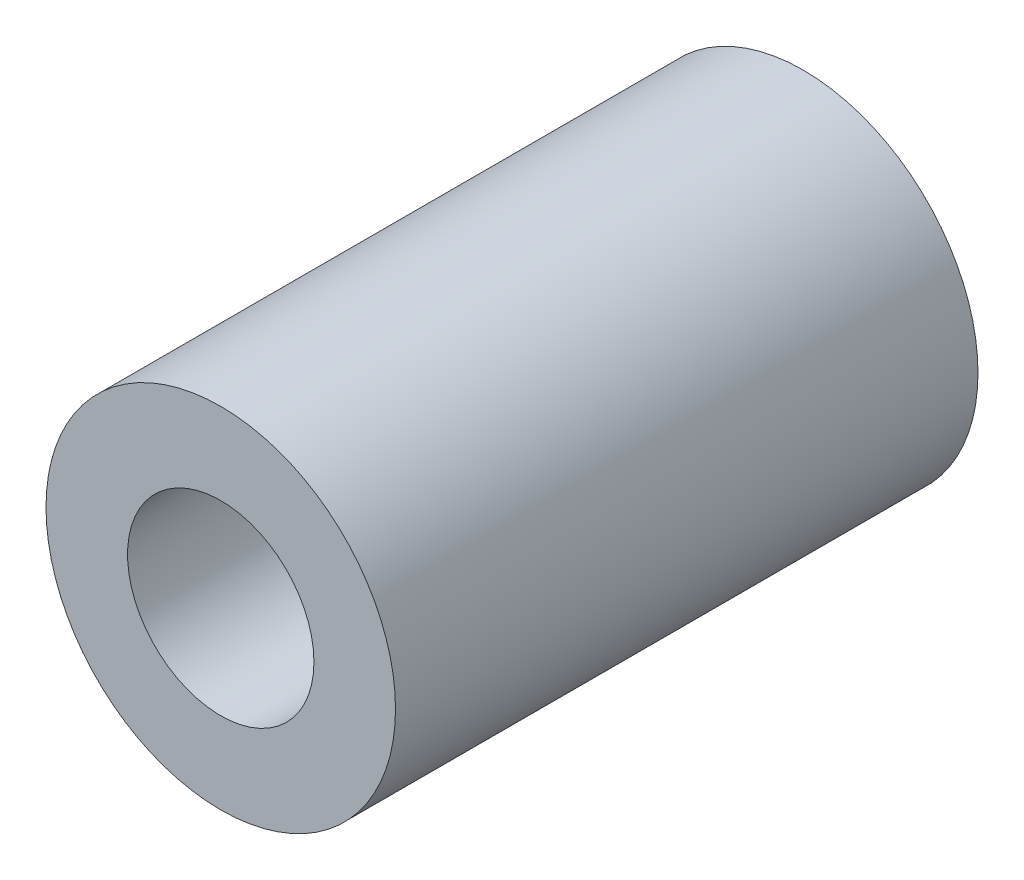
from build123d import *

# Parameters (mm, degrees)
SKETCH_1_R   = 3
SKETCH_1_R_2 = 1.6
F_10MM_DEPTH = 10


with BuildPart() as part:
    # 草图1 → 10mm铝柱 (new body)
    with BuildSketch(Plane.XY):
        Circle(SKETCH_1_R)
        Circle(SKETCH_1_R_2, mode=Mode.SUBTRACT)
    extrude(amount=F_10MM_DEPTH)


solid = part.part
